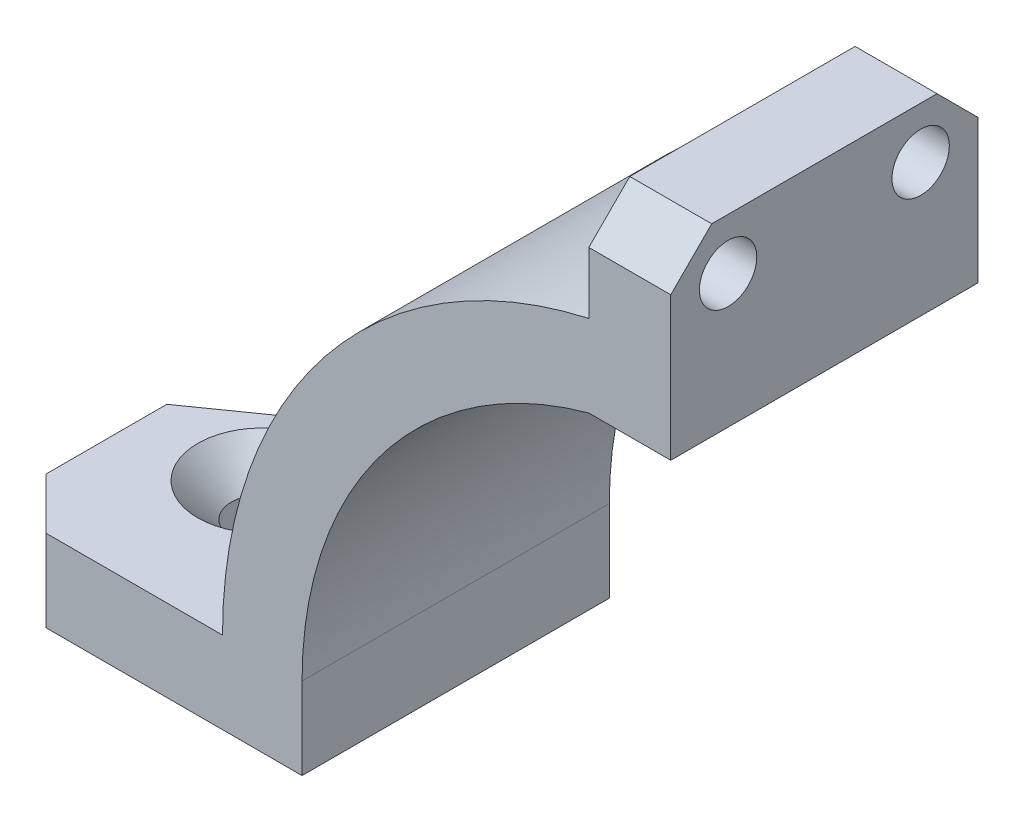
from build123d import *

# Parameters (mm, degrees)
BOSS_EXTRUDE1_DEPTH                             = 15
CHAMFER1_SIZE                                   = 2.5
SKETCH2_R                                       = 1.4
CUT_EXTRUDE1_DEPTH                              = 15
CHAMFER2_SIZE                                   = 2
SKETCH3_R                                       = 1.4
CUT_EXTRUDE2_DEPTH                              = 47.129659115
CUT_EXTRUDE3_DEPTH                              = 25
CSK_FOR_M3_FLAT_HEAD_MACHINE_SCREW1_D           = 3
CSK_FOR_M3_FLAT_HEAD_MACHINE_SCREW1_DEPTH       = 31.098709071
CSK_FOR_M3_FLAT_HEAD_MACHINE_SCREW1_CSINK_D     = 6.3
CSK_FOR_M3_FLAT_HEAD_MACHINE_SCREW1_CSINK_ANGLE = 90
CSK_FOR_M3_FLAT_HEAD_MACHINE_SCREW1_TIP         = 0.901290929


with BuildPart() as part:
    # Sketch1 → Boss-Extrude1 (new body)
    with BuildSketch(Plane.XY):
        with BuildLine():
            Line((-19, 0), (-19, -4))
            Line((-19, -4), (-34, -4))
            Line((-34, -4), (-34, 0))
            Line((-34, 0), (-22.883234523, 0))
            ThreePointArc((-22.883234523, 0), (-17.861391251, 14.304304416), (-5, 22.33030278))
            Line((-5, 22.33030278), (-5, 27.33030278))
            Line((-5, 27.33030278), (-1, 27.33030278))
            Line((-1, 27.33030278), (-1, 18.33030278))
            Line((-1, 18.33030278), (-5, 18.33030278))
            ThreePointArc((-5, 18.33030278), (-15.099668871, 11.532562595), (-19, 0))
        make_face()
    extrude(amount=BOSS_EXTRUDE1_DEPTH)

    # Chamfer1
    chamfer1_edges = [part.edges().sort_by_distance(p)[0] for p in [
        (-34, -2, 0),
        (-34, -2, 15),
    ]]
    chamfer(chamfer1_edges, length=CHAMFER1_SIZE)

    # Sketch2 → Cut-Extrude1 (cut)
    with BuildSketch(Plane.ZY.offset(5)):
        with Locations(Location((2.8, 24.83030278, 0), (0, 0, 270))):
            Circle(SKETCH2_R)
        with Locations(Location((12.2, 24.83030278, 0), (0, 0, 270))):
            Circle(SKETCH2_R)
    extrude(amount=-CUT_EXTRUDE1_DEPTH, mode=Mode.SUBTRACT)

    # Chamfer2
    chamfer2_edges = [part.edges().sort_by_distance(p)[0] for p in [
        (-3, 27.33030278, 0),
        (-3, 27.33030278, 15),
    ]]
    chamfer(chamfer2_edges, length=CHAMFER2_SIZE)

    # Sketch3 → Cut-Extrude2 (cut, through all)
    with BuildSketch(Plane(origin=(0, 0, 0), x_dir=(1, 0, 0), z_dir=(0, 1, 0))):
        with Locations(Location((-28.441617262, -7.5, 0), (0, 0, 270))):
            Circle(SKETCH3_R)
    extrude(amount=-CUT_EXTRUDE2_DEPTH, mode=Mode.SUBTRACT)

    # Sketch4 → Cut-Extrude3 (cut)
    with BuildSketch(Plane.XZ.offset(4)):
        Polygon((-24.636069701, 0), (-34, 6.600391812), (-34, 2.5), (-31.5, 0), align=None)
    extrude(amount=-CUT_EXTRUDE3_DEPTH, mode=Mode.SUBTRACT)

    # CSK for M3 Flat Head Machine Screw1
    with Locations(Plane(origin=(0, 0, 0), x_dir=(1, 0, 0), z_dir=(0, 1, 0))):
        with Locations((-28.441617262, -7.5)):
            CounterSinkHole(CSK_FOR_M3_FLAT_HEAD_MACHINE_SCREW1_D / 2, CSK_FOR_M3_FLAT_HEAD_MACHINE_SCREW1_CSINK_D / 2, depth=CSK_FOR_M3_FLAT_HEAD_MACHINE_SCREW1_DEPTH, counter_sink_angle=CSK_FOR_M3_FLAT_HEAD_MACHINE_SCREW1_CSINK_ANGLE)
            with Locations((0, 0, -(CSK_FOR_M3_FLAT_HEAD_MACHINE_SCREW1_DEPTH + CSK_FOR_M3_FLAT_HEAD_MACHINE_SCREW1_TIP / 2))):  # 118° drill point
                Cone(0, CSK_FOR_M3_FLAT_HEAD_MACHINE_SCREW1_D / 2, CSK_FOR_M3_FLAT_HEAD_MACHINE_SCREW1_TIP, mode=Mode.SUBTRACT)


solid = part.part
